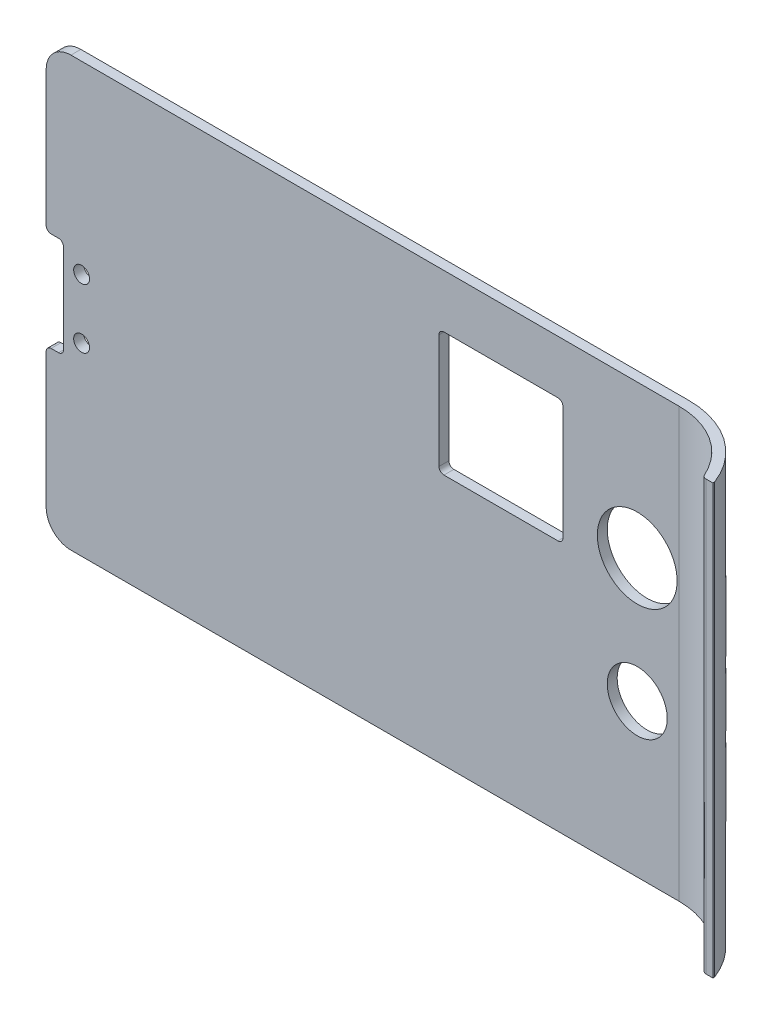
from build123d import *

# Parameters (mm, degrees)
EXTRUDE_1_DEPTH             = 2
EXTRUDE_2_REACH             = 86.23
EXTRUDE_2_DIRECTION_2_REACH = 86.23
CUT_EXTRUDE_2_DEPTH         = 114.341574455
FILLET_2_R                  = 1
SKETCH_8_R                  = 1.6
CUT_EXTRUDE_3_DEPTH         = 121.450189292
SKETCH_10_R                 = 1.6
SKETCH_10_W                 = 3.5
SKETCH_10_H                 = 20
CUT_EXTRUDE_5_DEPTH         = 86.056598939
SKETCH_11_R                 = 8.05
SKETCH_11_R_2               = 6.05
CUT_EXTRUDE_6_DEPTH         = 86.056598939
SKETCH_12_W                 = 25
SKETCH_12_H                 = 25
CUT_EXTRUDE_7_DEPTH         = 86.056598939
FILLET_3_R                  = 1


with BuildPart() as part:
    # 草图1 → 凸台-拉伸1 (new body)
    with BuildSketch(Plane.XY):
        with BuildLine():
            Line((72.25, -38.25), (72.25, 38.25))
            ThreePointArc((72.25, 38.25), (70.785533906, 41.785533906), (67.25, 43.25))
            Line((67.25, 43.25), (-67.25, 43.25))
            ThreePointArc((-67.25, 43.25), (-70.785533906, 41.785533906), (-72.25, 38.25))
            Line((-72.25, 38.25), (-72.25, -38.25))
            ThreePointArc((-72.25, -38.25), (-70.785533906, -41.785533906), (-67.25, -43.25))
            Line((-67.25, -43.25), (67.25, -43.25))
            ThreePointArc((67.25, -43.25), (70.785533906, -41.785533906), (72.25, -38.25))
        make_face()
    extrude(amount=EXTRUDE_1_DEPTH)

    # 凸台-拉伸2: up to this face of the body (flat: up to its plane)
    extrude_2_end = Plane(part.part.faces().sort_by_distance((0, 43.25, 1))[0])
    # 草图3 → 凸台-拉伸2 (add, up to the picked face)
    with BuildSketch(Plane(origin=(0, 0, 0), x_dir=(1, 0, 0), z_dir=(0, 1, 0)), mode=Mode.PRIVATE) as extrude_2_sk1:
        with BuildLine():
            Line((55.417603026, 0), (55.417603026, -2))
            ThreePointArc((55.417603026, -2), (64.361874936, -4.733500839), (70.25, -12))
            Line((70.25, -12), (72.25, -12))
            Line((72.25, -12), (72.25, -11.622664185))
            ThreePointArc((72.25, -11.622664185), (65.645211625, -3.187977102), (55.417603026, 0))
        make_face()
    extrude_2_tool1 = split(extrude(extrude_2_sk1.sketch, amount=EXTRUDE_2_REACH, mode=Mode.PRIVATE), bisect_by=extrude_2_end, keep=Keep.BOTH, mode=Mode.PRIVATE)
    add(extrude_2_tool1.solids().sort_by(Axis((64.519337, 0, 4.83454), (0, 1, 0)))[0])

    # 凸台-拉伸2 direction 2: up to this face of the body (flat: up to its plane)
    extrude_2_direction_2_end = Plane(part.part.faces().sort_by_distance((0, -43.25, 1))[0])
    # 草图3 → 凸台-拉伸2 direction 2 (add, up to the picked face)
    with BuildSketch(Plane(origin=(0, 0, 0), x_dir=(1, 0, 0), z_dir=(0, 1, 0)), mode=Mode.PRIVATE) as extrude_2_direction_2_sk1:
        with BuildLine():
            Line((55.417603026, 0), (55.417603026, -2))
            ThreePointArc((55.417603026, -2), (64.361874936, -4.733500839), (70.25, -12))
            Line((70.25, -12), (72.25, -12))
            Line((72.25, -12), (72.25, -11.622664185))
            ThreePointArc((72.25, -11.622664185), (65.645211625, -3.187977102), (55.417603026, 0))
        make_face()
    extrude_2_direction_2_tool1 = split(extrude(extrude_2_direction_2_sk1.sketch, amount=-EXTRUDE_2_DIRECTION_2_REACH, mode=Mode.PRIVATE), bisect_by=extrude_2_direction_2_end, keep=Keep.BOTH, mode=Mode.PRIVATE)
    add(extrude_2_direction_2_tool1.solids().sort_by(Axis((64.519337, 0, 4.83454), (0, -1, 0)))[0])

    # 草图6 → 切除-拉伸2 (cut, through all)
    with BuildSketch(Plane(origin=(0, 43.25, 0), x_dir=(1, 0, 0), z_dir=(0, 1, 0))):
        with BuildLine():
            Line((55.417603026, 0), (72.25, 0))
            Line((72.25, 0), (72.25, -2))
            Line((72.25, -2), (63.663814277, -2))
            ThreePointArc((63.663814277, -2), (59.660243713, -0.507144315), (55.417603026, 0))
        make_face()
    extrude(amount=-CUT_EXTRUDE_2_DEPTH, mode=Mode.SUBTRACT)

    # 圆角2
    fillet_2_edges = [part.edges().sort_by_distance(p)[0] for p in [
        (70.25, 0, 12),
    ]]
    fillet(fillet_2_edges, radius=FILLET_2_R)

    # 草图8 → 切除-拉伸3 (cut, through all)
    with BuildSketch(Plane(origin=(31.436723574, 0, -31.436723574), x_dir=(-0.7071067811865464, 0, -0.7071067811865488), z_dir=(0.7071067811865488, 0, -0.7071067811865464))):
        with Locations((-51.914084958, 6.5)):
            Circle(SKETCH_8_R)
        with Locations((-51.914084958, -6.5)):
            Circle(SKETCH_8_R)
    extrude(amount=-CUT_EXTRUDE_3_DEPTH, mode=Mode.SUBTRACT)

    # 草图10 → 切除-拉伸5 (cut, through all)
    with BuildSketch(Plane(origin=(0, 0, 0), x_dir=(-1, 0, 0), z_dir=(0, 0, -1))):
        with Locations(Location((65.1, 6, 0), (0, 0, 90))):
            Circle(SKETCH_10_R)
        with Locations(Location((65.1, -6, 0), (0, 0, 90))):
            Circle(SKETCH_10_R)
        with Locations((70.5, 0)):
            Rectangle(SKETCH_10_W, SKETCH_10_H)
    extrude(amount=-CUT_EXTRUDE_5_DEPTH, mode=Mode.SUBTRACT)

    # 草图11 → 切除-拉伸6 (cut, through all)
    with BuildSketch(Plane(origin=(0, 0, 0), x_dir=(-1, 0, 0), z_dir=(0, 0, -1))):
        with Locations((-47, 12.5)):
            Circle(SKETCH_11_R)
        with Locations((-47, -12.5)):
            Circle(SKETCH_11_R_2)
    extrude(amount=-CUT_EXTRUDE_6_DEPTH, mode=Mode.SUBTRACT)

    # 草图12 → 切除-拉伸7 (cut, through all)
    with BuildSketch(Plane(origin=(0, 0, 0), x_dir=(-1, 0, 0), z_dir=(0, 0, -1))):
        with Locations((-19.5, 20)):
            Rectangle(SKETCH_12_W, SKETCH_12_H)
    extrude(amount=-CUT_EXTRUDE_7_DEPTH, mode=Mode.SUBTRACT)

    # 圆角3
    fillet_3_edges = [part.edges().sort_by_distance(p)[0] for p in [
        (-72.25, 10, 1),
        (-72.25, -10, 1),
        (-68.75, -10, 1),
        (-68.75, 10, 1),
        (7, 32.5, 1),
        (7, 7.5, 1),
        (32, 7.5, 1),
        (32, 32.5, 1),
    ]]
    fillet(fillet_3_edges, radius=FILLET_3_R)


solid = part.part
